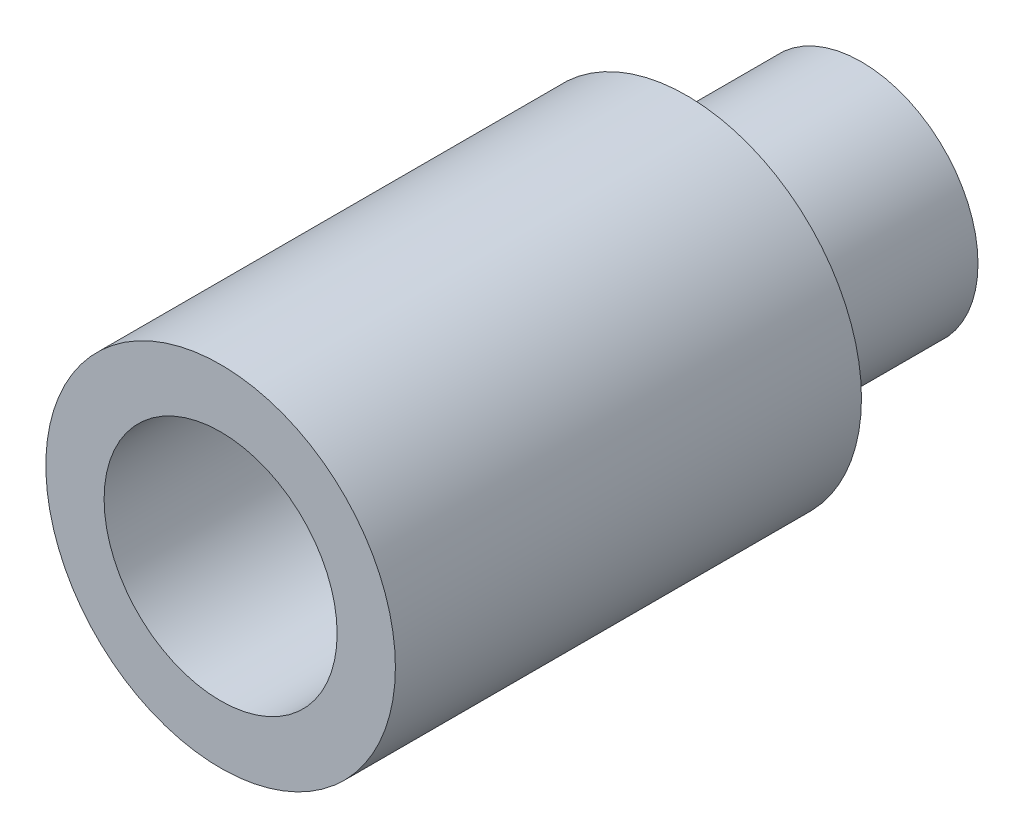
from build123d import *

# Parameters (mm, degrees)
SKETCH1_R           = 6.35
BOSS_EXTRUDE1_DEPTH = 9.525
SKETCH2_R           = 9.525
BOSS_EXTRUDE2_DEPTH = 25.4
CUT_EXTRUDE1_START  = -19.05
SKETCH3_R           = 6.35
CUT_EXTRUDE1_DEPTH  = 19.05


with BuildPart() as part:
    # Sketch1 → Boss-Extrude1 (new body)
    with BuildSketch(Plane.XY):
        with Locations(Location((0, 0, 0), (0, 0, 180))):
            Circle(SKETCH1_R)
    extrude(amount=BOSS_EXTRUDE1_DEPTH)

    # Sketch2 → Boss-Extrude2 (add)
    with BuildSketch(Plane.XY.offset(9.525)):
        Circle(SKETCH2_R)
    extrude(amount=BOSS_EXTRUDE2_DEPTH)

    # Sketch3 → Cut-Extrude1 (cut)
    with BuildSketch(Plane.XY.offset(34.925).offset(CUT_EXTRUDE1_START)):
        with Locations(Location((0, 0, 0), (0, 0, 180))):
            Circle(SKETCH3_R)
    extrude(amount=CUT_EXTRUDE1_DEPTH, mode=Mode.SUBTRACT)


solid = part.part
